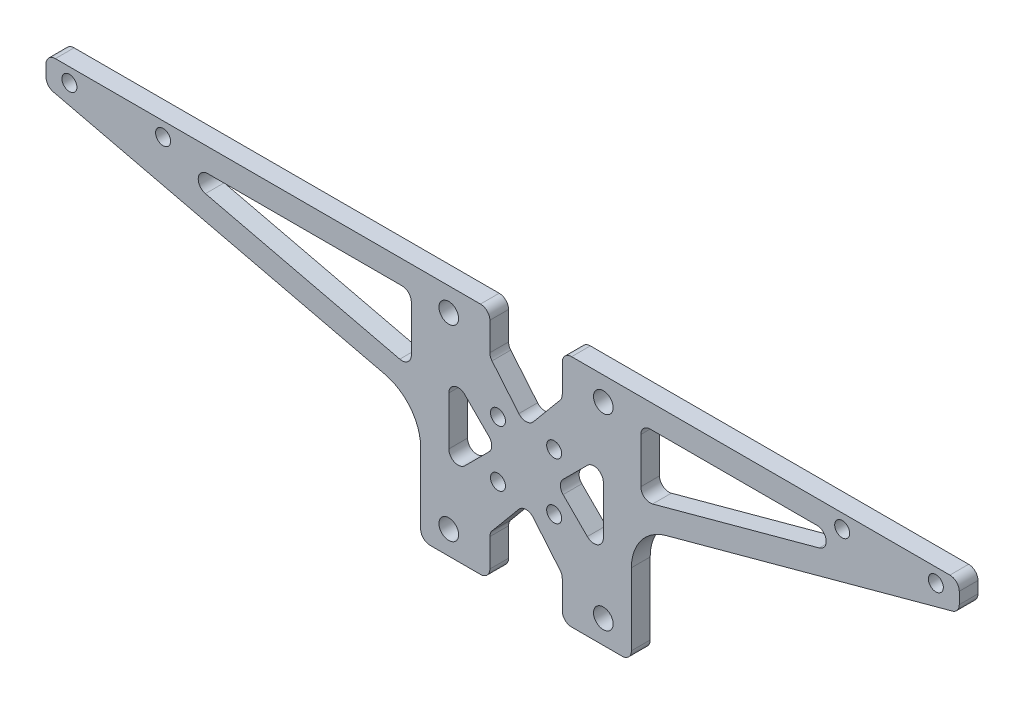
from build123d import *

# Parameters (mm, degrees)
SKETCH_1_W          = 45
SKETCH_1_H          = 50
SKETCH_1_R          = 1.6
SKETCH_1_R_2        = 2.1
EXTRUDE_1_DEPTH     = 4
FILLET_1_R          = 2
FILLET_2_R          = 10
CUT_EXTRUDE_1_DEPTH = 10
FILLET_3_R          = 2
SKETCH_3_W          = 5.729916775
SKETCH_3_H          = 6
CUT_EXTRUDE_2_DEPTH = 10
CUT_EXTRUDE_3_DEPTH = 10
FILLET_4_R          = 2
CUT_EXTRUDE_4_DEPTH = 10
FILLET_5_R          = 2
CUT_EXTRUDE_5_DEPTH = 10
SKETCH_8_R          = 1.6
CUT_EXTRUDE_6_DEPTH = 10
SKETCH_9_R          = 1.6
CUT_EXTRUDE_7_DEPTH = 10
FILLET_8_R          = 2


with BuildPart() as part:
    # 草图1 → 凸台-拉伸1 (new body)
    # profile 1 of 3: a face of its own
    with BuildSketch(Plane.XY):
        Polygon((-102.5, 25), (-102.5, 19), (-22.5, 0), (-22.5, 25), align=None)
    # profile 2 of 3: a face of its own
    with BuildSketch(Plane.XY):
        Rectangle(SKETCH_1_W, SKETCH_1_H)
        with Locations((-6, -6)):
            Circle(SKETCH_1_R, mode=Mode.SUBTRACT)
        with Locations((6, -6)):
            Circle(SKETCH_1_R, mode=Mode.SUBTRACT)
        with Locations((6, 6)):
            Circle(SKETCH_1_R, mode=Mode.SUBTRACT)
        with Locations((-6, 6)):
            Circle(SKETCH_1_R, mode=Mode.SUBTRACT)
        with Locations((-16.5, -20)):
            Circle(SKETCH_1_R_2, mode=Mode.SUBTRACT)
        with Locations((16.5, -20)):
            Circle(SKETCH_1_R_2, mode=Mode.SUBTRACT)
        with Locations((16.5, 20)):
            Circle(SKETCH_1_R_2, mode=Mode.SUBTRACT)
        with Locations((-16.5, 20)):
            Circle(SKETCH_1_R_2, mode=Mode.SUBTRACT)
    # profile 3 of 3: a face of its own
    with BuildSketch(Plane.XY):
        Polygon((92.5, 25), (22.5, 25), (22.5, 0), (92.5, 19), align=None)
    extrude(amount=EXTRUDE_1_DEPTH)

    # 圆角1
    fillet_1_edges = [part.edges().sort_by_distance(p)[0] for p in [
        (92.5, 25, 2),
        (92.5, 19, 2),
        (22.5, -25, 2),
        (-22.5, -25, 2),
        (-102.5, 19, 2),
        (-102.5, 25, 2),
    ]]
    fillet(fillet_1_edges, radius=FILLET_1_R)

    # 圆角2
    fillet_2_edges = [part.edges().sort_by_distance(p)[0] for p in [
        (22.5, 0, 2),
        (-22.5, 0, 2),
    ]]
    fillet(fillet_2_edges, radius=FILLET_2_R)

    # 草图2 → 切除-拉伸1 (cut)
    with BuildSketch(Plane.XY.offset(4)):
        Polygon((-10, 19), (10, 19), (0, 7), align=None)
        Polygon((0, -7), (-10, -19), (10, -19), align=None)
    extrude(amount=-CUT_EXTRUDE_1_DEPTH, mode=Mode.SUBTRACT)

    # 圆角3
    fillet_3_edges = [part.edges().sort_by_distance(p)[0] for p in [
        (0, 7, 2),
        (-10, 19, 2),
        (10, 19, 2),
        (10, -19, 2),
        (-10, -19, 2),
        (0, -7, 2),
    ]]
    fillet(fillet_3_edges, radius=FILLET_3_R)

    # 草图3 → 切除-拉伸2 (cut)
    with BuildSketch(Plane(origin=(0, 0, 0), x_dir=(-1, 0, 0), z_dir=(0, 0, -1))):
        with Locations((2.864958388, 22)):
            Rectangle(SKETCH_3_W, SKETCH_3_H)
        with Locations((-2.864958388, 22)):
            Rectangle(SKETCH_3_W, SKETCH_3_H)
        with Locations((2.864958388, -22)):
            Rectangle(SKETCH_3_W, SKETCH_3_H)
        with Locations((-2.864958388, -22)):
            Rectangle(SKETCH_3_W, SKETCH_3_H)
    extrude(amount=-CUT_EXTRUDE_2_DEPTH, mode=Mode.SUBTRACT)

    # 草图4 → 切除-拉伸3 (cut)
    with BuildSketch(Plane(origin=(0, 0, 0), x_dir=(-1, 0, 0), z_dir=(0, 0, -1))):
        with BuildLine():
            Line((-5.729916775, 25), (-7.729916775, 25))
            Line((-7.729916775, 25), (-7.729916775, 17))
            ThreePointArc((-7.729916775, 17), (-7.144130337, 18.414213562), (-5.729916775, 19))
            Line((-5.729916775, 19), (-5.729916775, 25))
        make_face()
        with BuildLine():
            Line((7.729916775, 25), (5.729916775, 25))
            Line((5.729916775, 25), (5.729916775, 19))
            ThreePointArc((5.729916775, 19), (7.144130337, 18.414213562), (7.729916775, 17))
            Line((7.729916775, 17), (7.729916775, 25))
        make_face()
        with BuildLine():
            Line((-7.729916775, -17), (-7.729916775, -25))
            Line((-7.729916775, -25), (-5.729916775, -25))
            Line((-5.729916775, -25), (-5.729916775, -19))
            ThreePointArc((-5.729916775, -19), (-7.144130337, -18.414213562), (-7.729916775, -17))
        make_face()
        with BuildLine():
            Line((5.729916775, -19), (5.729916775, -25))
            Line((5.729916775, -25), (7.729916775, -25))
            Line((7.729916775, -25), (7.729916775, -17))
            ThreePointArc((7.729916775, -17), (7.144130337, -18.414213562), (5.729916775, -19))
        make_face()
    extrude(amount=-CUT_EXTRUDE_3_DEPTH, mode=Mode.SUBTRACT)

    # 圆角4
    fillet_4_edges = [part.edges().sort_by_distance(p)[0] for p in [
        (7.729916775, 25, 2),
        (-7.729916775, 25, 2),
        (-7.729916775, -25, 2),
        (7.729916775, -25, 2),
    ]]
    fillet(fillet_4_edges, radius=FILLET_4_R)

    # 草图6 → 切除-拉伸4 (cut)
    with BuildSketch(Plane.XY.offset(4)):
        Polygon((6.5, 0), (16.5, 10), (16.5, -10), align=None)
        Polygon((-6.5, 0), (-16.5, -10), (-16.5, 10), align=None)
    extrude(amount=-CUT_EXTRUDE_4_DEPTH, mode=Mode.SUBTRACT)

    # 圆角5
    fillet_5_edges = [part.edges().sort_by_distance(p)[0] for p in [
        (16.5, -10, 2),
        (6.5, 0, 2),
        (16.5, 10, 2),
        (-16.5, 10, 2),
        (-6.5, 0, 2),
        (-16.5, -10, 2),
    ]]
    fillet(fillet_5_edges, radius=FILLET_5_R)

    # 草图7 → 切除-拉伸5 (cut)
    with BuildSketch(Plane.XY.offset(4)):
        Polygon((-85.07228941, 20), (-24.5, 5.614081265), (-24.5, 20), align=None)
        Polygon((24.5, 20), (24.5, 5.723767945), (77.096644415, 20), align=None)
    extrude(amount=-CUT_EXTRUDE_5_DEPTH, mode=Mode.SUBTRACT)

    # 草图8 → 切除-拉伸6 (cut)
    with BuildSketch(Plane.XY.offset(4)):
        with Locations((-97.5, 22)):
            Circle(SKETCH_8_R)
        with Locations((-77.5, 22)):
            Circle(SKETCH_8_R)
    extrude(amount=-CUT_EXTRUDE_6_DEPTH, mode=Mode.SUBTRACT)

    # 草图9 → 切除-拉伸7 (cut)
    with BuildSketch(Plane.XY.offset(4)):
        with Locations((87.5, 22)):
            Circle(SKETCH_9_R)
        with Locations((67.5, 22)):
            Circle(SKETCH_9_R)
    extrude(amount=-CUT_EXTRUDE_7_DEPTH, mode=Mode.SUBTRACT)

    # 圆角8
    fillet_8_edges = [part.edges().sort_by_distance(p)[0] for p in [
        (-85.07228941, 20, 2),
        (-24.5, 20, 2),
        (-24.5, 5.614081265, 2),
        (24.5, 20, 2),
        (77.096644415, 20, 2),
        (24.5, 5.723767945, 2),
    ]]
    fillet(fillet_8_edges, radius=FILLET_8_R)


solid = part.part
